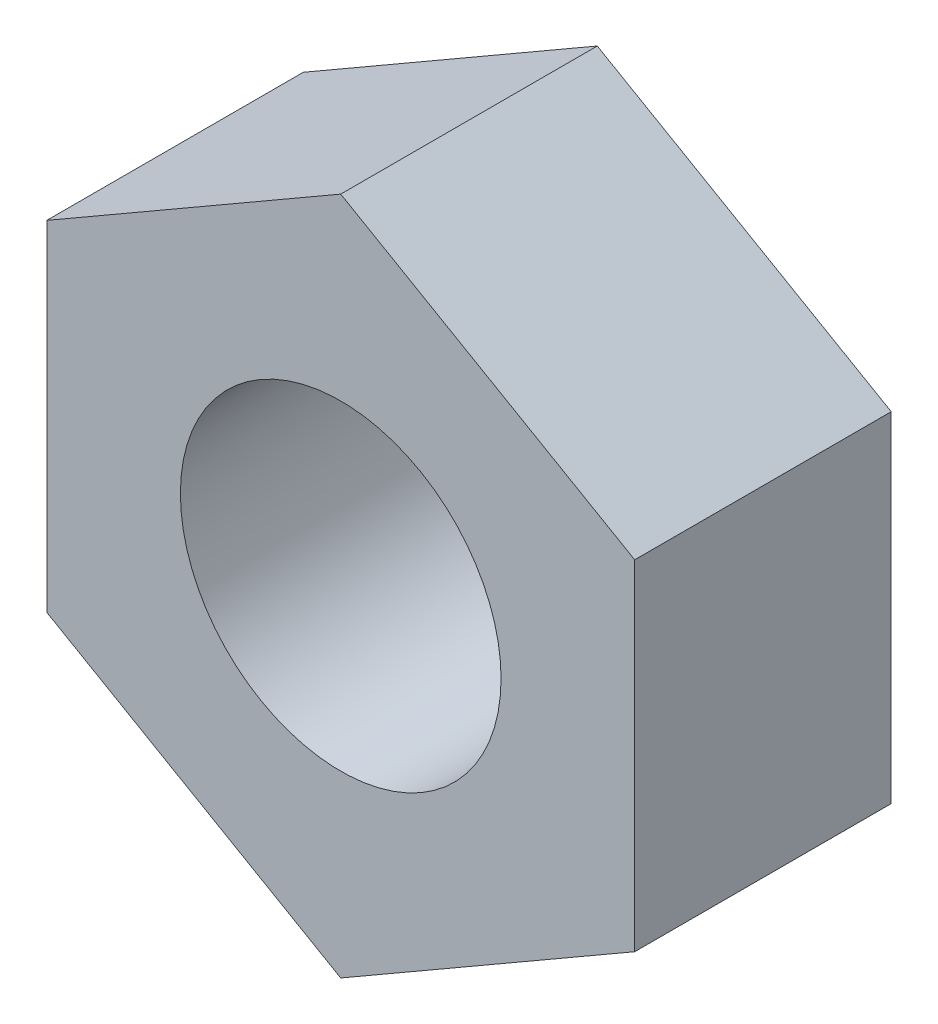
from build123d import *

# Parameters (mm, degrees)
CUERPO_DEPTH  = 2.4
SK_AGUJERO_R  = 1.5
AGUJERO_DEPTH = 2.4


with BuildPart() as part:
    # Sk_Cuerpo → Cuerpo (new body)
    with BuildSketch(Plane.XY):
        Polygon((0, -3.175426481), (2.75, -1.58771324), (2.75, 1.58771324), (0, 3.175426481), (-2.75, 1.58771324), (-2.75, -1.58771324), align=None)
    extrude(amount=CUERPO_DEPTH)

    # Sk_Agujero → Agujero (cut)
    with BuildSketch(Plane.XY):
        Circle(SK_AGUJERO_R)
    extrude(amount=AGUJERO_DEPTH, mode=Mode.SUBTRACT)


solid = part.part
